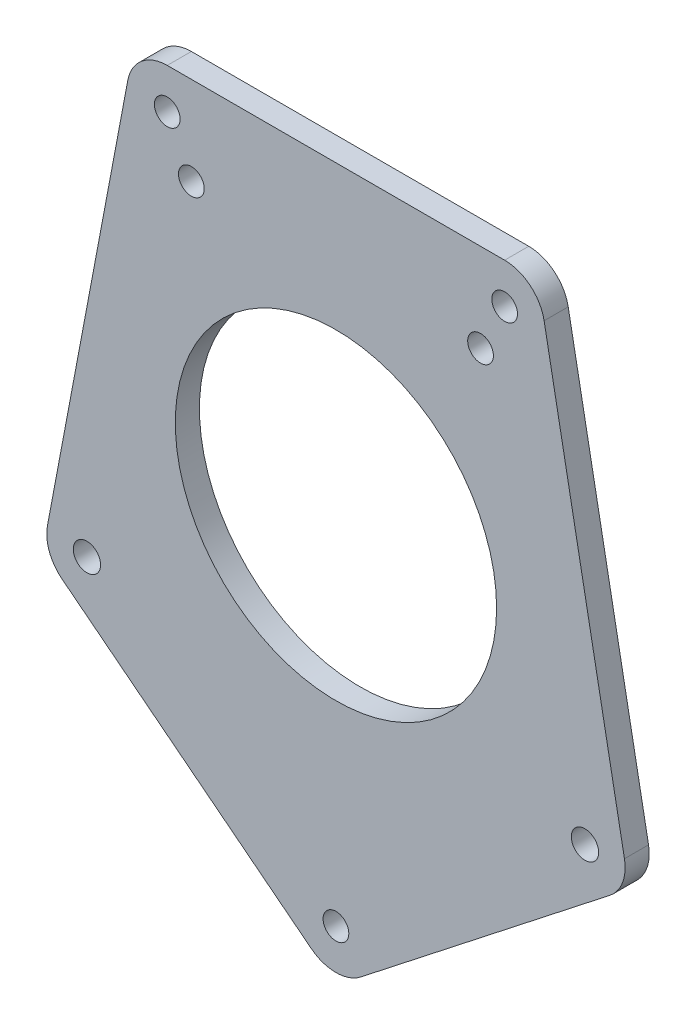
from build123d import *

# Parameters (mm, degrees)
SKETCH_1_R      = 1.6
SKETCH_1_R_2    = 1.7
SKETCH_1_R_3    = 20
EXTRUDE_1_DEPTH = 3


with BuildPart() as part:
    # 草图1 → 凸台-拉伸1 (new body)
    with BuildSketch(Plane.XY):
        with BuildLine():
            Line((21, 58), (-21, 58))
            ThreePointArc((-21, 58), (-24.190987584, 56.849363355), (-25.913308269, 53.927039296))
            Line((-25.913308269, 53.927039296), (-35.913308269, 0.927039296))
            ThreePointArc((-35.913308269, 0.927039296), (-35.679941102, -1.760156608), (-34.084620834, -3.935112998))
            Line((-34.084620834, -3.935112998), (-3.084620834, -28.235112998))
            ThreePointArc((-3.084620834, -28.235112998), (0, -29.3), (3.084620834, -28.235112998))
            Line((3.084620834, -28.235112998), (34.084620834, -3.935112998))
            ThreePointArc((34.084620834, -3.935112998), (35.679941102, -1.760156608), (35.913308269, 0.927039296))
            Line((35.913308269, 0.927039296), (25.913308269, 53.927039296))
            ThreePointArc((25.913308269, 53.927039296), (24.190987584, 56.849363355), (21, 58))
        make_face()
        with Locations((21, 53)):
            Circle(SKETCH_1_R, mode=Mode.SUBTRACT)
        with Locations((-21, 53)):
            Circle(SKETCH_1_R, mode=Mode.SUBTRACT)
        with Locations((31, 0)):
            Circle(SKETCH_1_R_2, mode=Mode.SUBTRACT)
        with Locations((-31, 0)):
            Circle(SKETCH_1_R_2, mode=Mode.SUBTRACT)
        with Locations((18, 47)):
            Circle(SKETCH_1_R, mode=Mode.SUBTRACT)
        with Locations((-18, 47)):
            Circle(SKETCH_1_R, mode=Mode.SUBTRACT)
        with Locations((0, -24.3)):
            Circle(SKETCH_1_R, mode=Mode.SUBTRACT)
        with Locations((0, 20)):
            Circle(SKETCH_1_R_3, mode=Mode.SUBTRACT)
    extrude(amount=EXTRUDE_1_DEPTH)


solid = part.part
